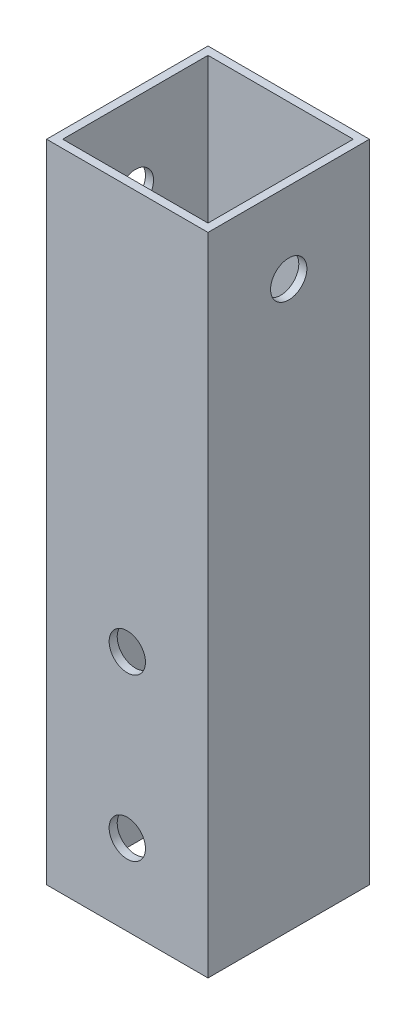
from build123d import *

# Parameters (mm, degrees)
SKETCH1_W           = 20
SKETCH1_H           = 20
SKETCH1_W_2         = 18
SKETCH1_H_2         = 18
BOSS_EXTRUDE1_DEPTH = 80
SKETCH2_R           = 2.25
CUT_EXTRUDE1_DEPTH  = 84.066238629
SKETCH3_R           = 2.25
CUT_EXTRUDE2_DEPTH  = 84.066238629


with BuildPart() as part:
    # Sketch1 → Boss-Extrude1 (new body)
    with BuildSketch(Plane(origin=(0, 0, 0), x_dir=(1, 0, 0), z_dir=(0, 1, 0))):
        Rectangle(SKETCH1_W, SKETCH1_H)
        Rectangle(SKETCH1_W_2, SKETCH1_H_2, mode=Mode.SUBTRACT)
    extrude(amount=BOSS_EXTRUDE1_DEPTH)

    # Sketch2 → Cut-Extrude1 (cut, through all)
    with BuildSketch(Plane.XY.offset(10)):
        with Locations((0, 10)):
            Circle(SKETCH2_R)
        with Locations((0, 30)):
            Circle(SKETCH2_R)
    extrude(amount=-CUT_EXTRUDE1_DEPTH, mode=Mode.SUBTRACT)

    # Sketch3 → Cut-Extrude2 (cut, through all)
    with BuildSketch(Plane(origin=(10, 0, 0), x_dir=(0, 0, -1), z_dir=(1, 0, 0))):
        with Locations((0, 70)):
            Circle(SKETCH3_R)
    extrude(amount=-CUT_EXTRUDE2_DEPTH, mode=Mode.SUBTRACT)


solid = part.part
